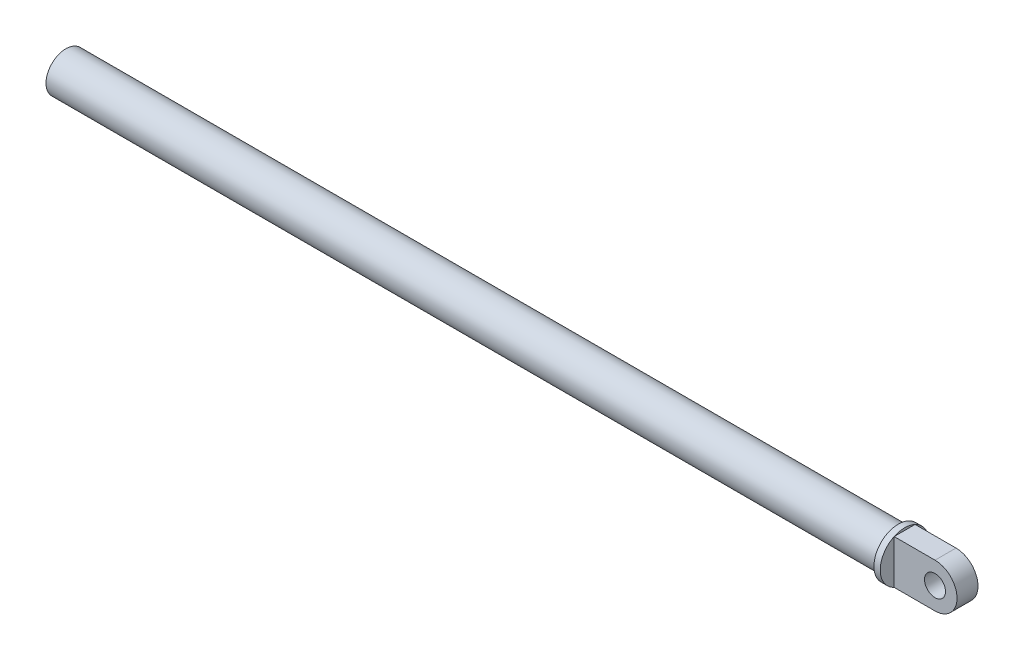
from build123d import *

# Parameters (mm, degrees)
SKETCH1_R            = 5
BOSS_EXTRUDE1_DEPTH  = 10
SKETCH2_R            = 11.62970335
BOSS_EXTRUDE9_DEPTH  = 3
SKETCH2_8_R          = 9.5
SKETCH2_8_R_2        = 8
BOSS_EXTRUDE10_DEPTH = 400


with BuildPart() as part:
    # Sketch1 → Boss-Extrude1 (new body)
    with BuildSketch(Plane.XY):
        with BuildLine():
            Line((-31.363787375, 14.15282392), (-50.863787375, 14.15282392))
            Line((-50.863787375, 14.15282392), (-50.863787375, -6.84717608))
            Line((-50.863787375, -6.84717608), (-31.363787375, -6.84717608))
            ThreePointArc((-31.363787375, -6.84717608), (-20.863787375, 3.65282392), (-31.363787375, 14.15282392))
        make_face()
        with Locations((-31.363787375, 3.65282392)):
            Circle(SKETCH1_R, mode=Mode.SUBTRACT)
    extrude(amount=BOSS_EXTRUDE1_DEPTH)

    # Sketch2 → Boss-Extrude9 (add)
    with BuildSketch(Plane.ZY.offset(50.863787375)):
        with Locations((5, 3.65282392)):
            Circle(SKETCH2_R)
    extrude(amount=BOSS_EXTRUDE9_DEPTH)

    # Sketch2<8> → Boss-Extrude10 (add)
    with BuildSketch(Plane.ZY.offset(50.863787375)):
        with Locations((5, 3.65282392)):
            Circle(SKETCH2_8_R)
        with Locations((5, 3.65282392)):
            Circle(SKETCH2_8_R_2, mode=Mode.SUBTRACT)
    extrude(amount=BOSS_EXTRUDE10_DEPTH)


solid = part.part
